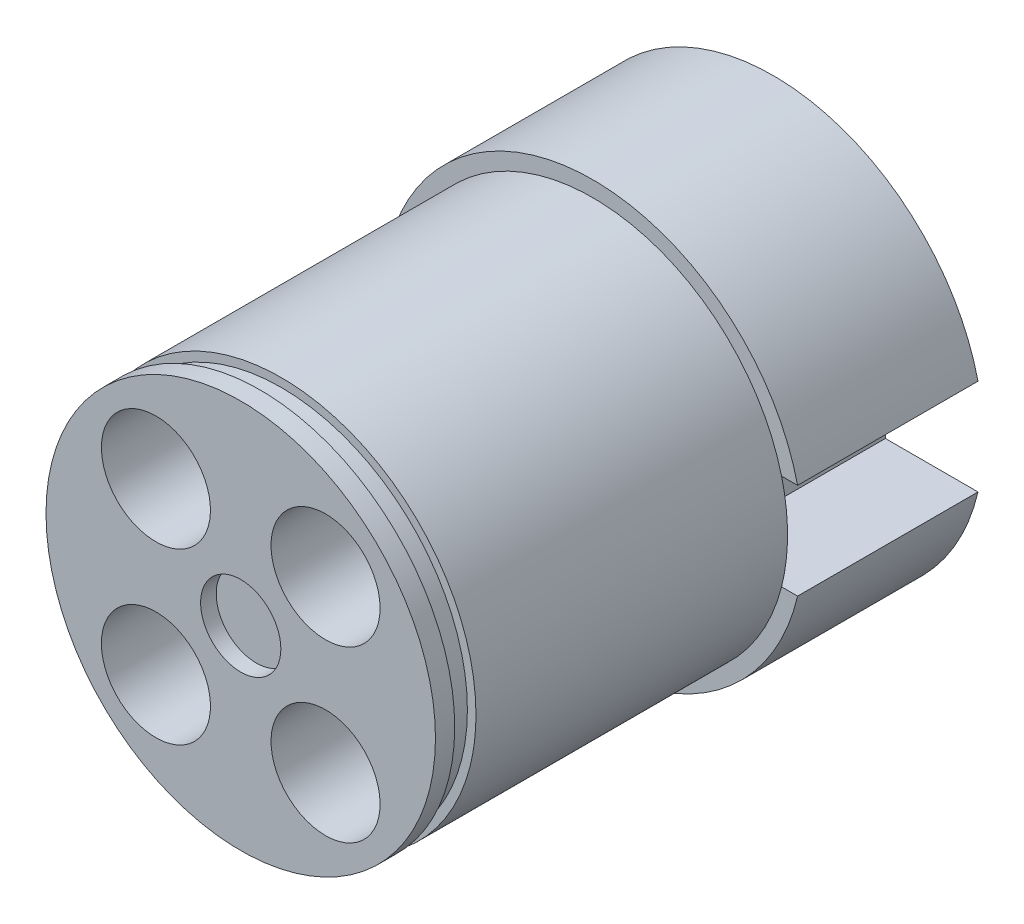
from build123d import *

# Parameters (mm, degrees)
SKETCH1_R           = 12.5
BOSS_EXTRUDE1_DEPTH = 22.6
SKETCH2_R           = 13.5
BOSS_EXTRUDE2_DEPTH = 11.58
SKETCH9_W           = 1.365
SKETCH9_H           = 0.55
SKETCH4_R           = 2.575
MAGNETSLOT_DEPTH    = 1
NUTCUT_DEPTH        = 30.18
SKETCH7_R           = 3.5
NUTHOLE_DEPTH       = 15
SKETCH8_R           = 1.35
SCREWHOLE_DEPTH     = 40.150637287
CIRPATTERN1_COUNT   = 4
SKETCH11_W          = 15.473481632
SKETCH11_H          = 6.154945972
CUT_EXTRUDE1_DEPTH  = 34.488804099


with BuildPart() as part:
    # Sketch1 → Boss-Extrude1 (new body)
    with BuildSketch(Plane.XY):
        Circle(SKETCH1_R)
    extrude(amount=BOSS_EXTRUDE1_DEPTH)

    # Sketch2 → Boss-Extrude2 (add)
    with BuildSketch(Plane.XY):
        Circle(SKETCH2_R)
    extrude(amount=-BOSS_EXTRUDE2_DEPTH)

    # Sketch9 → Cut-Revolve1 (revolve, cut)
    with BuildSketch(Plane(origin=(0, 0, 0), x_dir=(0, 0, -1), z_dir=(1, 0, 0)), mode=Mode.PRIVATE) as cut_revolve1_sk:
        with Locations((-20.6825, -12.225)):
            Rectangle(SKETCH9_W, SKETCH9_H)
    revolve(cut_revolve1_sk.sketch.rotate(Axis((0, 0, 24.309), (0, 0, -1)), 270), axis=Axis((0, 0, 24.309), (0, 0, -1)), mode=Mode.SUBTRACT)

    # Sketch4 → MagnetSlot (cut)
    with BuildSketch(Plane.XY.offset(22.6)):
        Circle(SKETCH4_R)
    magnetslot = extrude(amount=-MAGNETSLOT_DEPTH, mode=Mode.SUBTRACT)

    # Sketch6 → NutCut (cut)
    with BuildSketch(Plane.XY.offset(22.6)):
        Polygon((6.206811366, 8.288877648), (3.362655934, 7.526788497), (2.600566782, 4.682633064), (4.682633064, 2.600566782), (7.526788497, 3.362655934), (8.288877648, 6.206811366), align=None)
    nutcut = extrude(amount=-NUTCUT_DEPTH, mode=Mode.SUBTRACT)

    # Sketch7 → NutHole (cut)
    with BuildSketch(Plane.XY.offset(22.6)):
        with Locations((5.444722215, 5.444722215)):
            Circle(SKETCH7_R)
    nuthole = extrude(amount=-NUTHOLE_DEPTH, mode=Mode.SUBTRACT)

    # Sketch8 → ScrewHole (cut, symmetric)
    with BuildSketch(Plane.XY.offset(22.6)):
        with Locations((5.444722215, 5.444722215)):
            Circle(SKETCH8_R)
    screwhole = extrude(amount=SCREWHOLE_DEPTH, both=True, mode=Mode.SUBTRACT)

    # CirPattern1: MagnetSlot, NutCut, NutHole, ScrewHole ×4 about axis
    cirpattern1_axis = Axis((0, 0, 0), (0, 0, 1))
    add([magnetslot.rotate(cirpattern1_axis, i * 360 / CIRPATTERN1_COUNT) for i in range(1, CIRPATTERN1_COUNT)], mode=Mode.SUBTRACT)
    add([nutcut.rotate(cirpattern1_axis, i * 360 / CIRPATTERN1_COUNT) for i in range(1, CIRPATTERN1_COUNT)], mode=Mode.SUBTRACT)
    add([nuthole.rotate(cirpattern1_axis, i * 360 / CIRPATTERN1_COUNT) for i in range(1, CIRPATTERN1_COUNT)], mode=Mode.SUBTRACT)
    add([screwhole.rotate(cirpattern1_axis, i * 360 / CIRPATTERN1_COUNT) for i in range(1, CIRPATTERN1_COUNT)], mode=Mode.SUBTRACT)

    # Sketch11 → Cut-Extrude1 (cut, through all)
    with BuildSketch(Plane(origin=(7.2, 0, 0), x_dir=(0, 0, -1), z_dir=(1, 0, 0))):
        with Locations((7.736740816, 0)):
            Rectangle(SKETCH11_W, SKETCH11_H)
    extrude(amount=CUT_EXTRUDE1_DEPTH, mode=Mode.SUBTRACT)


solid = part.part
